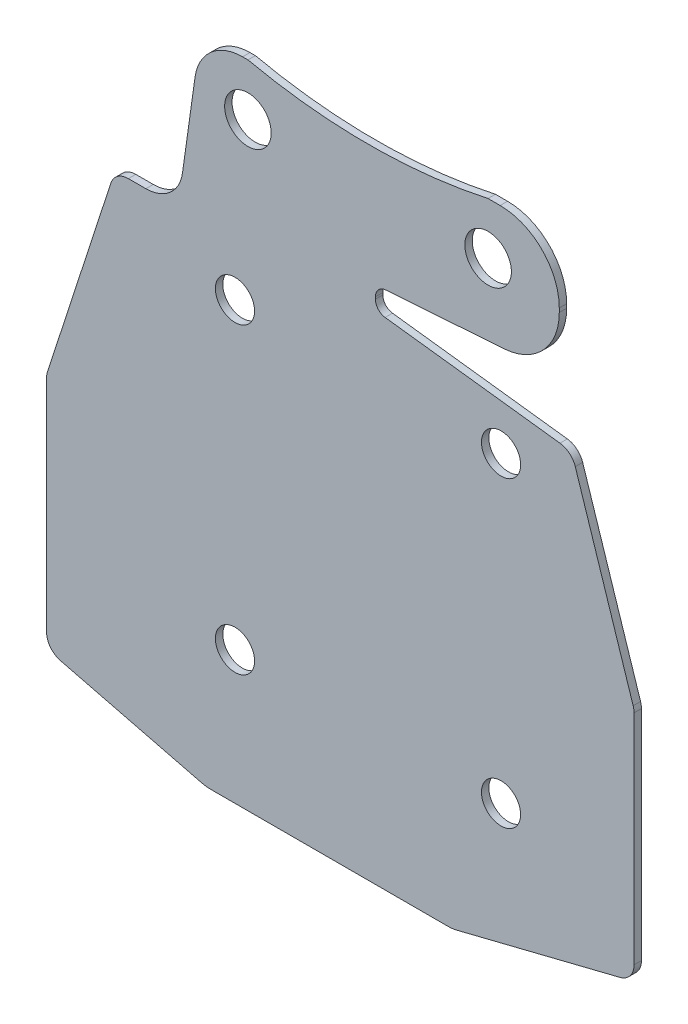
from build123d import *

# Parameters (mm, degrees)
RESSALTO_EXTRUS_O1_DEPTH = 1
FILETE1_R                = 5
FILETE2_R                = 6.5
FILETE3_R                = 8
FILETE4_R                = 1.5
FILETE5_R                = 2.5
FILETE6_R                = 2.5
FILETE7_R                = 2.5
FILETE9_R                = 5
FILETE10_R               = 2.5
FILETE11_R               = 2.5
ESBO_O2_R                = 2.65
ESBO_O2_R_2              = 3.15
CORTE_EXTRUS_O1_DEPTH    = 1
ESBO_O3_R                = 76.25
CORTE_EXTRUS_O2_DEPTH    = 1


with BuildPart() as part:
    # Esboço1 → Ressalto-extrusão1 (new body)
    with BuildSketch(Plane.XY):
        Polygon((-28.900998415, -44.564212679), (-50.493725783, -39.180541088), (-50.493725783, -7.064212679), (-41.23351444, 21.435787321), (-32.705131271, 21.435787321), (-29.613232907, 43.435787321), (18.886767093, 43.435787321), (18.886767093, 27.435787321), (-5.993725783, 25.695973775), (-5.993725783, 22.695973775), (20.558362115, 19.435787321), (29.006274217, -6.564212679), (29.006274217, -38.437470915), (4.433255164, -44.564212679), align=None)
    extrude(amount=RESSALTO_EXTRUS_O1_DEPTH)

    # Filete1
    filete1_edges = [part.edges().sort_by_distance(p)[0] for p in [
        (-32.705131271, 21.435787321, 0.5),
    ]]
    fillet(filete1_edges, radius=FILETE1_R)

    # Filete2
    filete2_edges = [part.edges().sort_by_distance(p)[0] for p in [
        (-29.613232907, 43.435787321, 0.5),
    ]]
    fillet(filete2_edges, radius=FILETE2_R)

    # Filete3
    filete3_edges = [part.edges().sort_by_distance(p)[0] for p in [
        (18.886767093, 43.435787321, 0.5),
        (18.886767093, 27.435787321, 0.5),
    ]]
    fillet(filete3_edges, radius=FILETE3_R)

    # Filete4
    filete4_edges = [part.edges().sort_by_distance(p)[0] for p in [
        (-5.993725783, 25.695973775, 0.5),
        (-5.993725783, 22.695973775, 0.5),
    ]]
    fillet(filete4_edges, radius=FILETE4_R)

    # Filete5
    filete5_edges = [part.edges().sort_by_distance(p)[0] for p in [
        (20.558362115, 19.435787321, 0.5),
    ]]
    fillet(filete5_edges, radius=FILETE5_R)

    # Filete6
    filete6_edges = [part.edges().sort_by_distance(p)[0] for p in [
        (29.006274217, -6.564212679, 0.5),
    ]]
    fillet(filete6_edges, radius=FILETE6_R)

    # Filete7
    filete7_edges = [part.edges().sort_by_distance(p)[0] for p in [
        (29.006274217, -38.437470915, 0.5),
    ]]
    fillet(filete7_edges, radius=FILETE7_R)

    # Filete9
    filete9_edges = [part.edges().sort_by_distance(p)[0] for p in [
        (-28.900998415, -44.564212679, 0.5),
        (4.433255164, -44.564212679, 0.5),
    ]]
    fillet(filete9_edges, radius=FILETE9_R)

    # Filete10
    filete10_edges = [part.edges().sort_by_distance(p)[0] for p in [
        (-50.493725783, -39.180541088, 0.5),
        (-50.493725783, -7.064212679, 0.5),
    ]]
    fillet(filete10_edges, radius=FILETE10_R)

    # Filete11
    filete11_edges = [part.edges().sort_by_distance(p)[0] for p in [
        (-41.23351444, 21.435787321, 0.5),
    ]]
    fillet(filete11_edges, radius=FILETE11_R)

    # Esboço2 → Corte-extrusão1 (cut)
    with BuildSketch(Plane.XY.offset(1)):
        with Locations((-24.993725783, -26.564212679)):
            Circle(ESBO_O2_R)
        with Locations((11.006274217, -26.564212679)):
            Circle(ESBO_O2_R)
        with Locations((-24.993725783, 14.435787321)):
            Circle(ESBO_O2_R)
        with Locations((11.006274217, 14.435787321)):
            Circle(ESBO_O2_R)
        with Locations((-23.243725783, 36.435787321)):
            Circle(ESBO_O2_R_2)
        with Locations((9.256274217, 36.435787321)):
            Circle(ESBO_O2_R_2)
    extrude(amount=-CORTE_EXTRUS_O1_DEPTH, mode=Mode.SUBTRACT)

    # Esboço3 → Corte-extrusão2 (cut)
    with BuildSketch(Plane.XY.offset(1)):
        with Locations((-6.993725783, 117.935787321)):
            Circle(ESBO_O3_R)
    extrude(amount=-CORTE_EXTRUS_O2_DEPTH, mode=Mode.SUBTRACT)


solid = part.part
